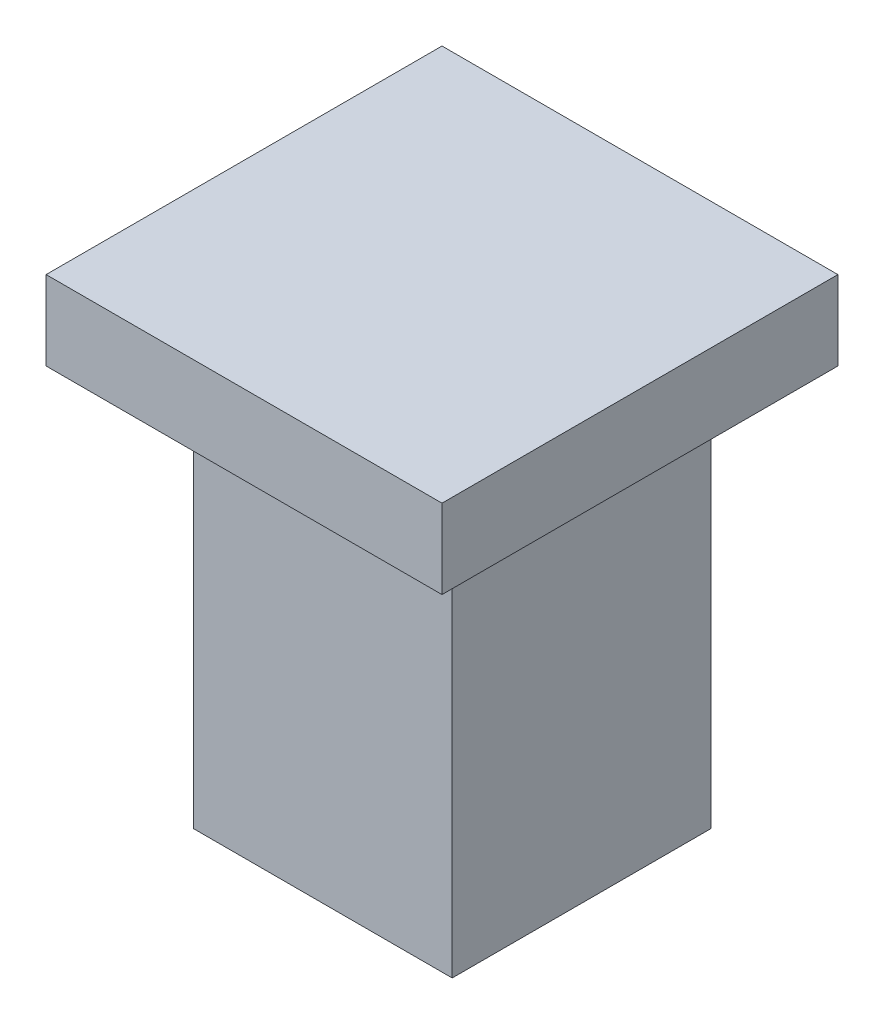
from build123d import *

# Parameters (mm, degrees)
SKETCH1_W           = 9.8
SKETCH1_H           = 9.8
BOSS_EXTRUDE1_DEPTH = 15
SKETCH2_W           = 15
SKETCH2_H           = 15
BOSS_EXTRUDE2_DEPTH = 3


with BuildPart() as part:
    # Sketch1 → Boss-Extrude1 (new body)
    with BuildSketch(Plane(origin=(0, 0, 0), x_dir=(1, 0, 0), z_dir=(0, 1, 0))):
        Rectangle(SKETCH1_W, SKETCH1_H)
    extrude(amount=BOSS_EXTRUDE1_DEPTH)

    # Sketch2 → Boss-Extrude2 (add)
    with BuildSketch(Plane(origin=(0, 15, 0), x_dir=(1, 0, 0), z_dir=(0, 1, 0))):
        with Locations((-0.374098318, -0.012352032)):
            Rectangle(SKETCH2_W, SKETCH2_H)
    extrude(amount=BOSS_EXTRUDE2_DEPTH)


solid = part.part
